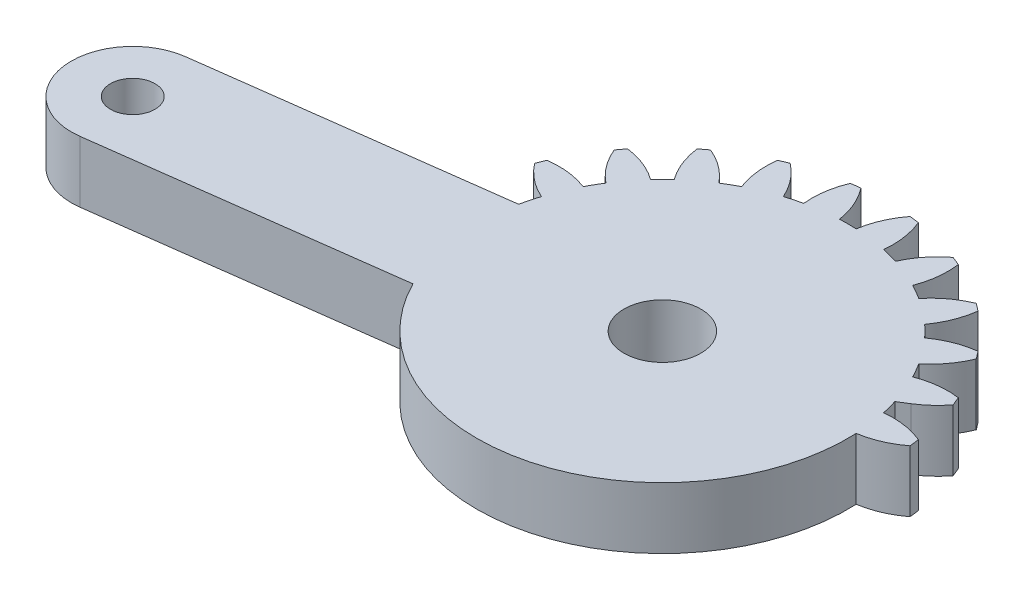
from build123d import *
from build123d.topology import SkipClean

# Parameters (mm, degrees)
SKETCH1_R           = 1.5
BOSS_EXTRUDE1_DEPTH = 4
SKETCH3_R           = 1.45
BOSS_EXTRUDE2_DEPTH = 4
CUT_EXTRUDE1_START  = -4
CUT_EXTRUDE1_DEPTH  = 4
CUT_EXTRUDE2_REACH  = 49.073
SKETCH5_R           = 2.5
SKETCH6_R           = 3.5
BOSS_EXTRUDE3_DEPTH = 1.5
SKETCH7_R           = 2.494074769
CUT_EXTRUDE3_DEPTH  = 48.224394497


with BuildPart() as part:
    # Sketch1 → Boss-Extrude1 (new body)
    with BuildSketch(Plane(origin=(0, 0, 0), x_dir=(1, 0, 0), z_dir=(0, 1, 0))):
        with BuildLine():
            Line((20.643657446, 4), (2.081641936, 4))
            ThreePointArc((2.081641936, 4), (2.861028333, 4.588201733), (3.521749436, 5.30713988))
            ThreePointArc((3.521749436, 5.30713988), (3.405395609, 5.596745198), (3.282888305, 5.883801663))
            ThreePointArc((3.282888305, 5.883801663), (1.93527598, 5.894040025), (0.627094961, 5.57027124))
            ThreePointArc((0.627094961, 5.57027124), (0.366286148, 6.046375), (0.084372603, 6.510293938))
            ThreePointArc((0.084372603, 6.510293938), (1.018855105, 7.48132754), (1.683794586, 8.65351323))
            ThreePointArc((1.683794586, 8.65351323), (1.496450048, 8.903135899), (1.303821399, 9.148703928))
            ThreePointArc((1.303821399, 9.148703928), (-0.000522033, 8.809805691), (-1.180330337, 8.158486898))
            ThreePointArc((-1.180330337, 8.158486898), (-1.555477026, 8.550865528), (-1.947855656, 8.926012217))
            ThreePointArc((-1.947855656, 8.926012217), (-1.296536862, 10.105820521), (-0.957638625, 11.410163953))
            ThreePointArc((-0.957638625, 11.410163953), (-1.203206655, 11.602792602), (-1.452829324, 11.79013714))
            ThreePointArc((-1.452829324, 11.79013714), (-2.625015014, 11.125197659), (-3.596048616, 10.190715157))
            ThreePointArc((-3.596048616, 10.190715157), (-4.059967554, 10.472628702), (-4.536071314, 10.733437515))
            ThreePointArc((-4.536071314, 10.733437515), (-4.212302529, 12.041618533), (-4.222540891, 13.389230859))
            ThreePointArc((-4.222540891, 13.389230859), (-4.509597355, 13.511738163), (-4.799202674, 13.62809199))
            ThreePointArc((-4.799202674, 13.62809199), (-5.759348103, 12.682425791), (-6.455432668, 11.528463019))
            ThreePointArc((-6.455432668, 11.528463019), (-6.976508546, 11.680699536), (-7.503891752, 11.809396783))
            ThreePointArc((-7.503891752, 11.809396783), (-7.529737283, 13.156800143), (-7.888414517, 14.455843809))
            ThreePointArc((-7.888414517, 14.455843809), (-8.197396993, 14.499881098), (-8.507248835, 14.537314892))
            ThreePointArc((-8.507248835, 14.537314892), (-9.18992168, 13.375367565), (-9.563620196, 12.080565177))
            ThreePointArc((-9.563620196, 12.080565177), (-10.106342554, 12.09275), (-10.649064912, 12.080565177))
            ThreePointArc((-10.649064912, 12.080565177), (-11.022763428, 13.375367565), (-11.705436272, 14.537314892))
            ThreePointArc((-11.705436272, 14.537314892), (-12.015288115, 14.499881098), (-12.324270591, 14.455843809))
            ThreePointArc((-12.324270591, 14.455843809), (-12.682947825, 13.156800143), (-12.708793355, 11.809396783))
            ThreePointArc((-12.708793355, 11.809396783), (-13.236176561, 11.680699536), (-13.757252439, 11.528463019))
            ThreePointArc((-13.757252439, 11.528463019), (-14.453337005, 12.682425791), (-15.413482434, 13.62809199))
            ThreePointArc((-15.413482434, 13.62809199), (-15.703087752, 13.511738163), (-15.990144217, 13.389230859))
            ThreePointArc((-15.990144217, 13.389230859), (-16.000382579, 12.041618533), (-15.676613793, 10.733437515))
            ThreePointArc((-15.676613793, 10.733437515), (-16.152717554, 10.472628702), (-16.616636492, 10.190715157))
            ThreePointArc((-16.616636492, 10.190715157), (-17.587670094, 11.125197659), (-18.759855783, 11.79013714))
            ThreePointArc((-18.759855783, 11.79013714), (-19.009478453, 11.602792602), (-19.255046482, 11.410163953))
            ThreePointArc((-19.255046482, 11.410163953), (-18.916148245, 10.105820521), (-18.264829452, 8.926012217))
            ThreePointArc((-18.264829452, 8.926012217), (-18.657208082, 8.550865528), (-19.032354771, 8.158486898))
            ThreePointArc((-19.032354771, 8.158486898), (-20.212163074, 8.809805691), (-21.516506507, 9.148703928))
            ThreePointArc((-21.516506507, 9.148703928), (-21.709135156, 8.903135899), (-21.896479694, 8.65351323))
            ThreePointArc((-21.896479694, 8.65351323), (-21.231540213, 7.48132754), (-20.297057711, 6.510293938))
            ThreePointArc((-20.297057711, 6.510293938), (-20.578971255, 6.046375), (-20.839780068, 5.57027124))
            ThreePointArc((-20.839780068, 5.57027124), (-22.147961087, 5.894040025), (-23.495573413, 5.883801663))
            ThreePointArc((-23.495573413, 5.883801663), (-23.618080717, 5.596745198), (-23.734434544, 5.30713988))
            ThreePointArc((-23.734434544, 5.30713988), (-22.788768345, 4.346994451), (-21.634805572, 3.650909885))
            ThreePointArc((-21.634805572, 3.650909885), (-21.78704209, 3.129834008), (-21.915739337, 2.602450802))
            ThreePointArc((-21.915739337, 2.602450802), (-23.263142697, 2.576605271), (-24.562186363, 2.217928037))
            ThreePointArc((-24.562186363, 2.217928037), (-24.606223651, 1.908945561), (-24.643657446, 1.599093719))
            ThreePointArc((-24.643657446, 1.599093719), (-23.481710119, 0.916420874), (-22.186907731, 0.542722358))
            ThreePointArc((-22.186907731, 0.542722358), (-22.199092554, 0), (-22.186907731, -0.542722358))
            ThreePointArc((-22.186907731, -0.542722358), (-23.481710119, -0.916420874), (-24.643657446, -1.599093719))
            ThreePointArc((-24.643657446, -1.599093719), (-24.606223651, -1.908945561), (-24.562186363, -2.217928037))
            ThreePointArc((-24.562186363, -2.217928037), (-23.263142697, -2.576605271), (-21.915739337, -2.602450802))
            ThreePointArc((-21.915739337, -2.602450802), (-21.78704209, -3.129834008), (-21.634805572, -3.650909885))
            ThreePointArc((-21.634805572, -3.650909885), (-22.788768345, -4.346994451), (-23.734434544, -5.30713988))
            ThreePointArc((-23.734434544, -5.30713988), (-23.618080717, -5.596745198), (-23.495573413, -5.883801663))
            ThreePointArc((-23.495573413, -5.883801663), (-22.147961087, -5.894040025), (-20.839780068, -5.57027124))
            ThreePointArc((-20.839780068, -5.57027124), (-20.578971255, -6.046375), (-20.297057711, -6.510293938))
            ThreePointArc((-20.297057711, -6.510293938), (-21.231540213, -7.48132754), (-21.896479694, -8.65351323))
            ThreePointArc((-21.896479694, -8.65351323), (-21.709135156, -8.903135899), (-21.516506507, -9.148703928))
            ThreePointArc((-21.516506507, -9.148703928), (-20.212163074, -8.809805691), (-19.032354771, -8.158486898))
            ThreePointArc((-19.032354771, -8.158486898), (-18.657208082, -8.550865528), (-18.264829452, -8.926012217))
            ThreePointArc((-18.264829452, -8.926012217), (-18.916148245, -10.105820521), (-19.255046482, -11.410163953))
            ThreePointArc((-19.255046482, -11.410163953), (-19.009478453, -11.602792602), (-18.759855783, -11.79013714))
            ThreePointArc((-18.759855783, -11.79013714), (-17.587670094, -11.125197659), (-16.616636492, -10.190715157))
            ThreePointArc((-16.616636492, -10.190715157), (-16.152717554, -10.472628702), (-15.676613793, -10.733437515))
            ThreePointArc((-15.676613793, -10.733437515), (-16.000382579, -12.041618533), (-15.990144217, -13.389230859))
            ThreePointArc((-15.990144217, -13.389230859), (-15.703087752, -13.511738163), (-15.413482434, -13.62809199))
            ThreePointArc((-15.413482434, -13.62809199), (-14.453337005, -12.682425791), (-13.757252439, -11.528463019))
            ThreePointArc((-13.757252439, -11.528463019), (-13.236176561, -11.680699536), (-12.708793355, -11.809396783))
            ThreePointArc((-12.708793355, -11.809396783), (-12.682947825, -13.156800143), (-12.324270591, -14.455843809))
            ThreePointArc((-12.324270591, -14.455843809), (-12.015288115, -14.499881098), (-11.705436272, -14.537314892))
            ThreePointArc((-11.705436272, -14.537314892), (-11.022763428, -13.375367565), (-10.649064912, -12.080565177))
            ThreePointArc((-10.649064912, -12.080565177), (-10.106342554, -12.09275), (-9.563620196, -12.080565177))
            ThreePointArc((-9.563620196, -12.080565177), (-9.18992168, -13.375367565), (-8.507248835, -14.537314892))
            ThreePointArc((-8.507248835, -14.537314892), (-8.197396993, -14.499881098), (-7.888414517, -14.455843809))
            ThreePointArc((-7.888414517, -14.455843809), (-7.529737283, -13.156800143), (-7.503891752, -11.809396783))
            ThreePointArc((-7.503891752, -11.809396783), (-6.976508546, -11.680699536), (-6.455432668, -11.528463019))
            ThreePointArc((-6.455432668, -11.528463019), (-5.759348103, -12.682425791), (-4.799202674, -13.62809199))
            ThreePointArc((-4.799202674, -13.62809199), (-4.509597355, -13.511738163), (-4.222540891, -13.389230859))
            ThreePointArc((-4.222540891, -13.389230859), (-4.212302529, -12.041618533), (-4.536071314, -10.733437515))
            ThreePointArc((-4.536071314, -10.733437515), (-4.059967554, -10.472628702), (-3.596048616, -10.190715157))
            ThreePointArc((-3.596048616, -10.190715157), (-2.625015014, -11.125197659), (-1.452829324, -11.79013714))
            ThreePointArc((-1.452829324, -11.79013714), (-1.203206655, -11.602792602), (-0.957638625, -11.410163953))
            ThreePointArc((-0.957638625, -11.410163953), (-1.296536862, -10.105820521), (-1.947855656, -8.926012217))
            ThreePointArc((-1.947855656, -8.926012217), (-1.555477026, -8.550865528), (-1.180330337, -8.158486898))
            ThreePointArc((-1.180330337, -8.158486898), (-0.000522033, -8.809805691), (1.303821399, -9.148703928))
            ThreePointArc((1.303821399, -9.148703928), (1.496450048, -8.903135899), (1.683794586, -8.65351323))
            ThreePointArc((1.683794586, -8.65351323), (1.018855105, -7.48132754), (0.084372603, -6.510293938))
            ThreePointArc((0.084372603, -6.510293938), (0.366286148, -6.046375), (0.627094961, -5.57027124))
            ThreePointArc((0.627094961, -5.57027124), (1.93527598, -5.894040025), (3.282888305, -5.883801663))
            ThreePointArc((3.282888305, -5.883801663), (3.405395609, -5.596745198), (3.521749436, -5.30713988))
            ThreePointArc((3.521749436, -5.30713988), (2.861028333, -4.588201733), (2.081641936, -4))
            Line((2.081641936, -4), (20.643657446, -4))
            ThreePointArc((20.643657446, -4), (24.643657446, 0), (20.643657446, 4))
        make_face()
        with Locations(Location((-10.106342554, 0, 0), (0, 0, 270))):
            Circle(SKETCH1_R, mode=Mode.SUBTRACT)
        with Locations(Location((20.643657446, 0, 0), (0, 0, 270))):
            Circle(SKETCH1_R, mode=Mode.SUBTRACT)
    extrude(amount=BOSS_EXTRUDE1_DEPTH)

    # Sketch3 → Boss-Extrude2 (add)
    with BuildSketch(Plane(origin=(0, 4, 0), x_dir=(1, 0, 0), z_dir=(0, 1, 0))):
        with BuildLine():
            ThreePointArc((-9.584237785, -3.965779445), (-14.072121999, -0.522104769), (-10.628447323, 3.965779445))
            Line((-10.628447323, 3.965779445), (-41.11537681, -0.047900965))
            ThreePointArc((-41.11537681, -0.047900965), (-44.559051487, -4.53578518), (-40.071167272, -7.979459856))
            Line((-40.071167272, -7.979459856), (-9.584237785, -3.965779445))
        make_face()
        with Locations(Location((-40.593272041, -4.013680411, 0), (0, 0, 270))):
            Circle(SKETCH3_R, mode=Mode.SUBTRACT)
    extrude(amount=-BOSS_EXTRUDE2_DEPTH)

    # Sketch4 → Cut-Extrude1 (cut)
    with SkipClean():  # the faces are left unmerged after this step: merging them gives an invalid solid
        with BuildSketch(Plane(origin=(0, 4, 0), x_dir=(1, 0, 0), z_dir=(0, 1, 0)).offset(CUT_EXTRUDE1_START)):
            with BuildLine():
                ThreePointArc((20.643657446, -4), (24.643657446, 0), (20.643657446, 4))
                Line((20.643657446, 4), (2.081641936, 4))
                Line((2.081641936, 4), (1.43808022, 3.600125745))
                ThreePointArc((1.43808022, 3.600125745), (1.581217534, 3.104116905), (1.70305423, 2.602450802))
                ThreePointArc((1.70305423, 2.602450802), (3.050457589, 2.576605271), (4.349501255, 2.217928037))
                ThreePointArc((4.349501255, 2.217928037), (4.393538544, 1.908945561), (4.430972339, 1.599093719))
                ThreePointArc((4.430972339, 1.599093719), (3.269025011, 0.916420874), (1.974222624, 0.542722358))
                ThreePointArc((1.974222624, 0.542722358), (1.70305423, -2.602450802), (0.627094961, -5.57027124))
                ThreePointArc((0.627094961, -5.57027124), (1.93527598, -5.894040025), (3.282888305, -5.883801663))
                ThreePointArc((3.282888305, -5.883801663), (3.405395609, -5.596745198), (3.521749436, -5.30713988))
                ThreePointArc((3.521749436, -5.30713988), (2.861028333, -4.588201733), (2.081641936, -4))
                Line((2.081641936, -4), (20.643657446, -4))
            make_face()
            with BuildLine():
                ThreePointArc((1.683794586, -8.65351323), (1.018855105, -7.48132754), (0.084372603, -6.510293938))
                ThreePointArc((0.084372603, -6.510293938), (-0.512518948, -7.361599771), (-1.180330337, -8.158486898))
                ThreePointArc((-1.180330337, -8.158486898), (-0.000522033, -8.809805691), (1.303821399, -9.148703928))
                ThreePointArc((1.303821399, -9.148703928), (1.496450048, -8.903135899), (1.683794586, -8.65351323))
            make_face()
            with BuildLine():
                ThreePointArc((-0.957638625, -11.410163953), (-1.296536862, -10.105820521), (-1.947855656, -8.926012217))
                ThreePointArc((-1.947855656, -8.926012217), (-2.744742783, -9.593823606), (-3.596048616, -10.190715157))
                ThreePointArc((-3.596048616, -10.190715157), (-2.625015014, -11.125197659), (-1.452829324, -11.79013714))
                ThreePointArc((-1.452829324, -11.79013714), (-1.203206655, -11.602792602), (-0.957638625, -11.410163953))
            make_face()
            with BuildLine():
                ThreePointArc((-4.222540891, -13.389230859), (-4.212302529, -12.041618533), (-4.536071314, -10.733437515))
                ThreePointArc((-4.536071314, -10.733437515), (-5.478647477, -11.172244217), (-6.455432668, -11.528463019))
                ThreePointArc((-6.455432668, -11.528463019), (-5.759348103, -12.682425791), (-4.799202674, -13.62809199))
                ThreePointArc((-4.799202674, -13.62809199), (-4.509597355, -13.511738163), (-4.222540891, -13.389230859))
            make_face()
            with BuildLine():
                ThreePointArc((-7.888414517, -14.455843809), (-7.529737283, -13.156800143), (-7.503891752, -11.809396783))
                ThreePointArc((-7.503891752, -11.809396783), (-8.527921943, -11.989294847), (-9.563620196, -12.080565177))
                ThreePointArc((-9.563620196, -12.080565177), (-9.18992168, -13.375367565), (-8.507248835, -14.537314892))
                ThreePointArc((-8.507248835, -14.537314892), (-8.197396993, -14.499881098), (-7.888414517, -14.455843809))
            make_face()
            with BuildLine():
                ThreePointArc((-11.705436272, -14.537314892), (-11.022763428, -13.375367565), (-10.649064912, -12.080565177))
                ThreePointArc((-10.649064912, -12.080565177), (-11.684763165, -11.989294847), (-12.708793355, -11.809396783))
                ThreePointArc((-12.708793355, -11.809396783), (-12.682947825, -13.156800143), (-12.324270591, -14.455843809))
                ThreePointArc((-12.324270591, -14.455843809), (-12.015288115, -14.499881098), (-11.705436272, -14.537314892))
            make_face()
            with BuildLine():
                ThreePointArc((-15.413482434, -13.62809199), (-14.453337005, -12.682425791), (-13.757252439, -11.528463019))
                ThreePointArc((-13.757252439, -11.528463019), (-14.734037631, -11.172244217), (-15.676613793, -10.733437515))
                ThreePointArc((-15.676613793, -10.733437515), (-16.000382579, -12.041618533), (-15.990144217, -13.389230859))
                ThreePointArc((-15.990144217, -13.389230859), (-15.703087752, -13.511738163), (-15.413482434, -13.62809199))
            make_face()
            with BuildLine():
                ThreePointArc((-18.759855783, -11.79013714), (-17.587670094, -11.125197659), (-16.616636492, -10.190715157))
                ThreePointArc((-16.616636492, -10.190715157), (-17.467942324, -9.593823606), (-18.264829452, -8.926012217))
                ThreePointArc((-18.264829452, -8.926012217), (-18.916148245, -10.105820521), (-19.255046482, -11.410163953))
                ThreePointArc((-19.255046482, -11.410163953), (-19.009478453, -11.602792602), (-18.759855783, -11.79013714))
            make_face()
            with BuildLine():
                ThreePointArc((-21.516506507, -9.148703928), (-20.212163074, -8.809805691), (-19.032354771, -8.158486898))
                ThreePointArc((-19.032354771, -8.158486898), (-19.70016616, -7.361599771), (-20.297057711, -6.510293938))
                ThreePointArc((-20.297057711, -6.510293938), (-21.231540213, -7.48132754), (-21.896479694, -8.65351323))
                ThreePointArc((-21.896479694, -8.65351323), (-21.709135156, -8.903135899), (-21.516506507, -9.148703928))
            make_face()
            with BuildLine():
                ThreePointArc((-21.942853375, 2.47620963), (-21.92946485, 2.539366405), (-21.915739337, 2.602450802))
                ThreePointArc((-21.915739337, 2.602450802), (-23.263142697, 2.576605271), (-24.562186363, 2.217928037))
                ThreePointArc((-24.562186363, 2.217928037), (-24.56889027, 2.173784387), (-24.575459377, 2.129620475))
                Line((-24.575459377, 2.129620475), (-21.942853375, 2.47620963))
            make_face()
            with BuildLine():
                ThreePointArc((-23.495573413, -5.883801663), (-22.147961087, -5.894040025), (-20.839780068, -5.57027124))
                ThreePointArc((-20.839780068, -5.57027124), (-20.869365339, -5.512888815), (-20.898643838, -5.455349261))
                Line((-20.898643838, -5.455349261), (-23.531249839, -5.801938416))
                ThreePointArc((-23.531249839, -5.801938416), (-23.513474108, -5.842897269), (-23.495573413, -5.883801663))
            make_face()
        extrude(amount=CUT_EXTRUDE1_DEPTH, mode=Mode.SUBTRACT)

    # Sketch5 → Cut-Extrude2 (cut, up to next)
    with BuildSketch(Plane(origin=(0, 4, 0), x_dir=(1, 0, 0), z_dir=(0, 1, 0)), mode=Mode.PRIVATE) as cut_extrude2_sk1:
        with Locations(Location((-10.106342554, 0, 0), (0, 0, 270))):
            Circle(SKETCH5_R)
    cut_extrude2_tool1 = extrude(cut_extrude2_sk1.sketch, amount=-CUT_EXTRUDE2_REACH, mode=Mode.PRIVATE) & part.part
    add(cut_extrude2_tool1.solids().sort_by_distance((-10.106343, 4, 0))[0], mode=Mode.SUBTRACT)

    # Sketch6 → Boss-Extrude3 (add)
    with SkipClean():  # the faces are left unmerged after this step: merging them gives an invalid solid
        with BuildSketch(Plane(origin=(0, 0, 0), x_dir=(-1, 0, 0), z_dir=(0, -1, 0))):
            with Locations(Location((10.106342554, 0, 0), (0, 0, 270))):
                Circle(SKETCH6_R)
        extrude(amount=BOSS_EXTRUDE3_DEPTH)

    # Sketch7 → Cut-Extrude3 (cut, through all)
    with SkipClean():  # the faces are left unmerged after this step: merging them gives an invalid solid
        with BuildSketch(Plane.XZ.offset(1.5)):
            with Locations(Location((-10.106342554, 0, 0), (0, 0, 270))):
                Circle(SKETCH7_R)
        extrude(amount=-CUT_EXTRUDE3_DEPTH, mode=Mode.SUBTRACT)


solid = part.part
